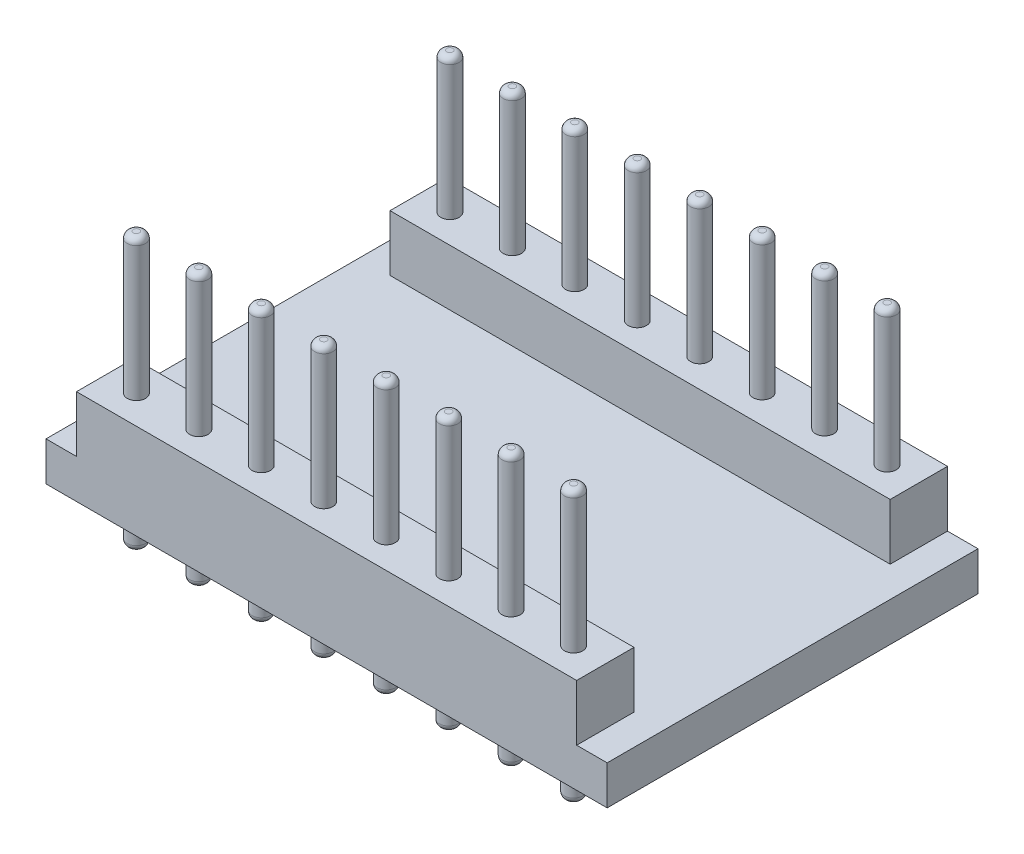
from build123d import *

# Parameters (mm, degrees)
SKETCH1_W           = 23
SKETCH1_H           = 15.2
BOSS_EXTRUDE1_DEPTH = 1.6
SKETCH2_W           = 20.5
SKETCH2_H           = 2.35
BOSS_EXTRUDE2_DEPTH = 2.3
SKETCH3_R           = 0.375
BOSS_EXTRUDE3_DEPTH = 5.75
FILLET1_R           = 0.25
BOSS_EXTRUDE4_START = 1.5
SKETCH4_R           = 0.375
BOSS_EXTRUDE4_DEPTH = 1.5
FILLET2_R           = 0.25


with BuildPart() as part:
    # Sketch1 → Boss-Extrude1 (new body)
    with BuildSketch(Plane(origin=(0, 0, 0), x_dir=(1, 0, 0), z_dir=(0, 1, 0))):
        with Locations((11.5, 7.6)):
            Rectangle(SKETCH1_W, SKETCH1_H)
    extrude(amount=BOSS_EXTRUDE1_DEPTH)

    # Sketch2 → Boss-Extrude2 (add)
    with BuildSketch(Plane(origin=(0, 1.6, 0), x_dir=(1, 0, 0), z_dir=(0, 1, 0))):
        with Locations((11.5, 14.025)):
            Rectangle(SKETCH2_W, SKETCH2_H)
        with Locations((11.5, 1.175)):
            Rectangle(SKETCH2_W, SKETCH2_H)
    extrude(amount=BOSS_EXTRUDE2_DEPTH)

    # Sketch3 → Boss-Extrude3 (add)
    with BuildSketch(Plane(origin=(0, 3.9, 0), x_dir=(1, 0, 0), z_dir=(0, 1, 0))):
        with Locations((2.53, 14.025)):
            Circle(SKETCH3_R)
        with Locations((5.09, 14.025)):
            Circle(SKETCH3_R)
        with Locations((7.65, 14.025)):
            Circle(SKETCH3_R)
        with Locations((10.21, 14.025)):
            Circle(SKETCH3_R)
        with Locations((12.77, 14.025)):
            Circle(SKETCH3_R)
        with Locations((15.33, 14.025)):
            Circle(SKETCH3_R)
        with Locations((17.89, 14.025)):
            Circle(SKETCH3_R)
        with Locations((20.45, 14.025)):
            Circle(SKETCH3_R)
        with Locations((20.45, 1.175)):
            Circle(SKETCH3_R)
        with Locations((17.89, 1.175)):
            Circle(SKETCH3_R)
        with Locations((15.33, 1.175)):
            Circle(SKETCH3_R)
        with Locations((12.77, 1.175)):
            Circle(SKETCH3_R)
        with Locations((10.21, 1.175)):
            Circle(SKETCH3_R)
        with Locations((7.65, 1.175)):
            Circle(SKETCH3_R)
        with Locations((5.09, 1.175)):
            Circle(SKETCH3_R)
        with Locations((2.53, 1.175)):
            Circle(SKETCH3_R)
    extrude(amount=BOSS_EXTRUDE3_DEPTH)

    # Fillet1
    fillet1_edges = [part.edges().sort_by_distance(p)[0] for p in [
        (2.155, 9.65, -1.175),
        (4.715, 9.65, -1.175),
        (7.275, 9.65, -1.175),
        (9.835, 9.65, -1.175),
        (12.395, 9.65, -1.175),
        (14.955, 9.65, -1.175),
        (17.515, 9.65, -1.175),
        (20.075, 9.65, -1.175),
        (20.075, 9.65, -14.025),
        (12.395, 9.65, -14.025),
        (17.515, 9.65, -14.025),
        (14.955, 9.65, -14.025),
        (9.835, 9.65, -14.025),
        (7.275, 9.65, -14.025),
        (4.715, 9.65, -14.025),
        (2.155, 9.65, -14.025),
    ]]
    fillet(fillet1_edges, radius=FILLET1_R)

    # Sketch4 → Boss-Extrude4 (add)
    with BuildSketch(Plane.XZ.offset(BOSS_EXTRUDE4_START)):
        with Locations((20.45, -1.175)):
            Circle(SKETCH4_R)
        with Locations((17.89, -1.175)):
            Circle(SKETCH4_R)
        with Locations((2.53, -1.175)):
            Circle(SKETCH4_R)
        with Locations((5.09, -1.175)):
            Circle(SKETCH4_R)
        with Locations((7.65, -1.175)):
            Circle(SKETCH4_R)
        with Locations((10.21, -1.175)):
            Circle(SKETCH4_R)
        with Locations((12.77, -1.175)):
            Circle(SKETCH4_R)
        with Locations((15.33, -1.175)):
            Circle(SKETCH4_R)
        with Locations((20.45, -14.025)):
            Circle(SKETCH4_R)
        with Locations((17.89, -14.025)):
            Circle(SKETCH4_R)
        with Locations((15.33, -14.025)):
            Circle(SKETCH4_R)
        with Locations((12.77, -14.025)):
            Circle(SKETCH4_R)
        with Locations((10.21, -14.025)):
            Circle(SKETCH4_R)
        with Locations((2.53, -14.025)):
            Circle(SKETCH4_R)
        with Locations((5.09, -14.025)):
            Circle(SKETCH4_R)
        with Locations((7.65, -14.025)):
            Circle(SKETCH4_R)
    extrude(amount=-BOSS_EXTRUDE4_DEPTH)

    # Fillet2
    fillet2_edges = [part.edges().sort_by_distance(p)[0] for p in [
        (20.075, -1.5, -1.175),
        (14.955, -1.5, -1.175),
        (17.515, -1.5, -1.175),
        (12.395, -1.5, -1.175),
        (9.835, -1.5, -1.175),
        (7.275, -1.5, -1.175),
        (4.715, -1.5, -1.175),
        (2.155, -1.5, -1.175),
        (20.075, -1.5, -14.025),
        (17.515, -1.5, -14.025),
        (14.955, -1.5, -14.025),
        (12.395, -1.5, -14.025),
        (9.835, -1.5, -14.025),
        (7.275, -1.5, -14.025),
        (4.715, -1.5, -14.025),
        (2.155, -1.5, -14.025),
    ]]
    fillet(fillet2_edges, radius=FILLET2_R)


solid = part.part
